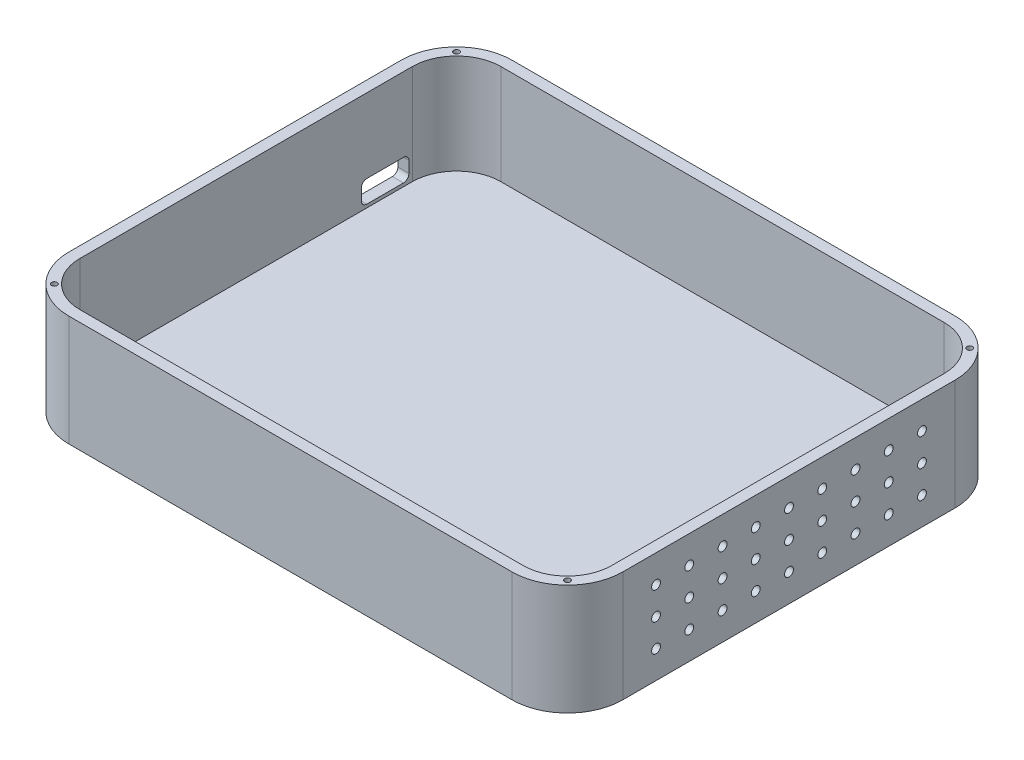
from build123d import *

# Parameters (mm, degrees)
SKETCH1_W           = 127
SKETCH1_H           = 101.6
BOSS_EXTRUDE1_DEPTH = 2.54
SKETCH2_W           = 127
SKETCH2_H           = 101.6
SKETCH2_W_2         = 121.92
SKETCH2_H_2         = 96.52
BOSS_EXTRUDE2_DEPTH = 22.86
FILLET1_R           = 10.16
FILLET2_R           = 12.7
SKETCH3_R           = 1.016
CUT_EXTRUDE1_DEPTH  = 2.54
SKETCH4_W           = 10.922
SKETCH4_H           = 5.08
CUT_EXTRUDE2_DEPTH  = 2.54
FILLET3_R           = 1.27
SKETCH6_R           = 0.635
CUT_EXTRUDE4_DEPTH  = 7.62


with BuildPart() as part:
    # Sketch1 → Boss-Extrude1 (new body)
    with BuildSketch(Plane(origin=(0, 0, 0), x_dir=(1, 0, 0), z_dir=(0, 1, 0))):
        with Locations((63.5, 50.8)):
            Rectangle(SKETCH1_W, SKETCH1_H)
    extrude(amount=BOSS_EXTRUDE1_DEPTH)

    # Sketch2 → Boss-Extrude2 (add)
    with BuildSketch(Plane(origin=(0, 2.54, 0), x_dir=(1, 0, 0), z_dir=(0, 1, 0))):
        with Locations((63.5, 50.8)):
            Rectangle(SKETCH2_W, SKETCH2_H)
        with Locations((63.5, 50.8)):
            Rectangle(SKETCH2_W_2, SKETCH2_H_2, mode=Mode.SUBTRACT)
    extrude(amount=BOSS_EXTRUDE2_DEPTH)

    # Fillet1
    fillet1_edges = [part.edges().sort_by_distance(p)[0] for p in [
        (124.46, 13.97, -99.06),
        (2.54, 13.97, -99.06),
        (2.54, 13.97, -2.54),
        (124.46, 13.97, -2.54),
    ]]
    fillet(fillet1_edges, radius=FILLET1_R)

    # Fillet2
    fillet2_edges = [part.edges().sort_by_distance(p)[0] for p in [
        (0, 12.7, -101.6),
        (127, 12.7, -101.6),
        (127, 12.7, 0),
        (0, 12.7, 0),
    ]]
    fillet(fillet2_edges, radius=FILLET2_R)

    # Sketch3 → Cut-Extrude1 (cut)
    with BuildSketch(Plane(origin=(127, 0, 0), x_dir=(0, 0, -1), z_dir=(1, 0, 0))):
        with Locations((50.8, 12.7)):
            Circle(SKETCH3_R)
        with Locations((58.42, 12.7)):
            Circle(SKETCH3_R)
        with Locations((66.04, 12.7)):
            Circle(SKETCH3_R)
        with Locations((73.66, 12.7)):
            Circle(SKETCH3_R)
        with Locations((81.28, 12.7)):
            Circle(SKETCH3_R)
        with Locations((43.18, 12.7)):
            Circle(SKETCH3_R)
        with Locations((35.56, 12.7)):
            Circle(SKETCH3_R)
        with Locations((27.94, 12.7)):
            Circle(SKETCH3_R)
        with Locations((20.32, 12.7)):
            Circle(SKETCH3_R)
        with Locations((20.32, 19.05)):
            Circle(SKETCH3_R)
        with Locations((27.94, 19.05)):
            Circle(SKETCH3_R)
        with Locations((35.56, 19.05)):
            Circle(SKETCH3_R)
        with Locations((43.18, 19.05)):
            Circle(SKETCH3_R)
        with Locations((50.8, 19.05)):
            Circle(SKETCH3_R)
        with Locations((58.42, 19.05)):
            Circle(SKETCH3_R)
        with Locations((66.04, 19.05)):
            Circle(SKETCH3_R)
        with Locations((73.66, 19.05)):
            Circle(SKETCH3_R)
        with Locations((81.28, 19.05)):
            Circle(SKETCH3_R)
        with Locations((20.32, 6.35)):
            Circle(SKETCH3_R)
        with Locations((27.94, 6.35)):
            Circle(SKETCH3_R)
        with Locations((35.56, 6.35)):
            Circle(SKETCH3_R)
        with Locations((43.18, 6.35)):
            Circle(SKETCH3_R)
        with Locations((50.8, 6.35)):
            Circle(SKETCH3_R)
        with Locations((58.42, 6.35)):
            Circle(SKETCH3_R)
        with Locations((66.04, 6.35)):
            Circle(SKETCH3_R)
        with Locations((73.66, 6.35)):
            Circle(SKETCH3_R)
        with Locations((81.28, 6.35)):
            Circle(SKETCH3_R)
    extrude(amount=-CUT_EXTRUDE1_DEPTH, mode=Mode.SUBTRACT)

    # Sketch4 → Cut-Extrude2 (cut)
    with BuildSketch(Plane.ZY):
        with Locations((-82.677, 5.842)):
            Rectangle(SKETCH4_W, SKETCH4_H)
    extrude(amount=-CUT_EXTRUDE2_DEPTH, mode=Mode.SUBTRACT)

    # Fillet3
    fillet3_edges = [part.edges().sort_by_distance(p)[0] for p in [
        (1.27, 8.382, -77.216),
        (1.27, 8.382, -88.138),
        (1.27, 3.302, -88.138),
        (1.27, 3.302, -77.216),
    ]]
    fillet(fillet3_edges, radius=FILLET3_R)

    # Sketch6 → Cut-Extrude4 (cut)
    with BuildSketch(Plane(origin=(0, 25.4, 0), x_dir=(1, 0, 0), z_dir=(0, 1, 0))):
        with Locations(Location((4.681771045, 4.708740144, 0), (0, 0, 270))):
            Circle(SKETCH6_R)
        with Locations(Location((4.681771045, 96.891259856, 0), (0, 0, 270))):
            Circle(SKETCH6_R)
        with Locations(Location((122.318228955, 96.891259856, 0), (0, 0, 270))):
            Circle(SKETCH6_R)
        with Locations(Location((122.318228955, 4.708740144, 0), (0, 0, 270))):
            Circle(SKETCH6_R)
    extrude(amount=-CUT_EXTRUDE4_DEPTH, mode=Mode.SUBTRACT)


solid = part.part
